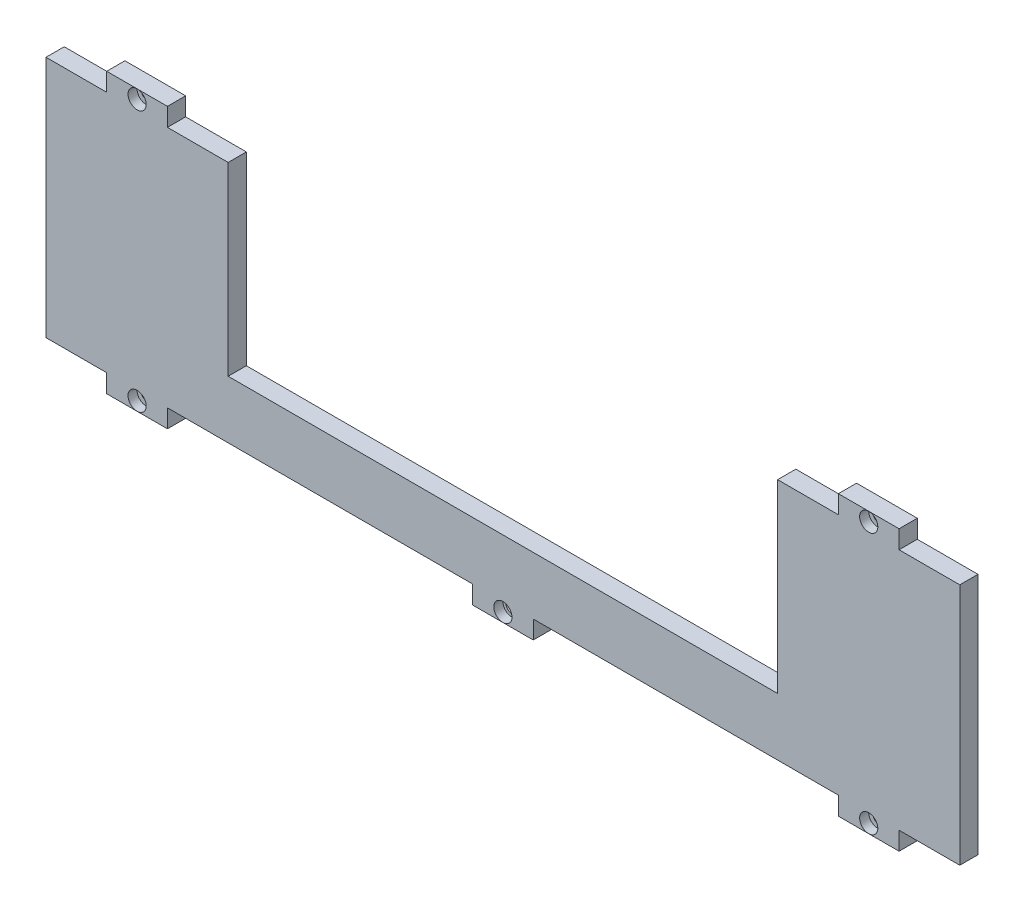
from build123d import *

# Parameters (mm, degrees)
BOSS_EXTRU_1_DEPTH      = 6
ESQUISSE2_W             = 181
ESQUISSE2_H             = 61
ENL_V_MAT_EXTRU_1_DEPTH = 314.10221973
ESQUISSE4_R             = 1.5
ESQUISSE4_R_2           = 2.037365752
ENL_V_MAT_EXTRU_2_DEPTH = 314.10221973
ESQUISSE5_R             = 2.995
ENL_V_MAT_EXTRU_3_DEPTH = 3


with BuildPart() as part:
    # Esquisse1 → Boss.-Extru.1 (new body)
    with BuildSketch(Plane.XY):
        Polygon((-301, 80), (-281, 80), (-281, 86), (-261, 86), (-261, 80), (-40, 80), (-40, 86), (-20, 86), (-20, 80), (0, 80), (0, 0), (-20, 0), (-20, -6), (-40, -6), (-40, 0), (-140.5, 0), (-140.5, -6), (-160.5, -6), (-160.5, 0), (-261, 0), (-261, -6), (-281, -6), (-281, 0), (-301, 0), align=None)
    extrude(amount=BOSS_EXTRU_1_DEPTH)

    # Esquisse2 → Enlèv. mat.-Extru.1 (cut, through all)
    with BuildSketch(Plane.XY.offset(6)):
        with Locations((-150.5, 49.5)):
            Rectangle(ESQUISSE2_W, ESQUISSE2_H)
    extrude(amount=-ENL_V_MAT_EXTRU_1_DEPTH, mode=Mode.SUBTRACT)

    # Esquisse4 → Enlèv. mat.-Extru.2 (cut, through all)
    with BuildSketch(Plane.XY.offset(6)):
        with Locations((-271, 83)):
            Circle(ESQUISSE4_R)
        with Locations((-30, 83)):
            Circle(ESQUISSE4_R)
        with Locations(Location((-30, -3, 0), (0, 0, 180))):
            Circle(ESQUISSE4_R)
        with Locations(Location((-271, -3, 0), (0, 0, 180))):
            Circle(ESQUISSE4_R)
        with Locations((-150.5, -3)):
            Circle(ESQUISSE4_R_2)
    extrude(amount=-ENL_V_MAT_EXTRU_2_DEPTH, mode=Mode.SUBTRACT)

    # Esquisse5 → Enlèv. mat.-Extru.3 (cut)
    with BuildSketch(Plane.XY.offset(6)):
        with Locations((-271, 83)):
            Circle(ESQUISSE5_R)
        with Locations((-30, 83)):
            Circle(ESQUISSE5_R)
        with Locations((-271, -3)):
            Circle(ESQUISSE5_R)
        with Locations((-150.5, -3)):
            Circle(ESQUISSE5_R)
        with Locations((-30, -3)):
            Circle(ESQUISSE5_R)
    extrude(amount=-ENL_V_MAT_EXTRU_3_DEPTH, mode=Mode.SUBTRACT)


solid = part.part
